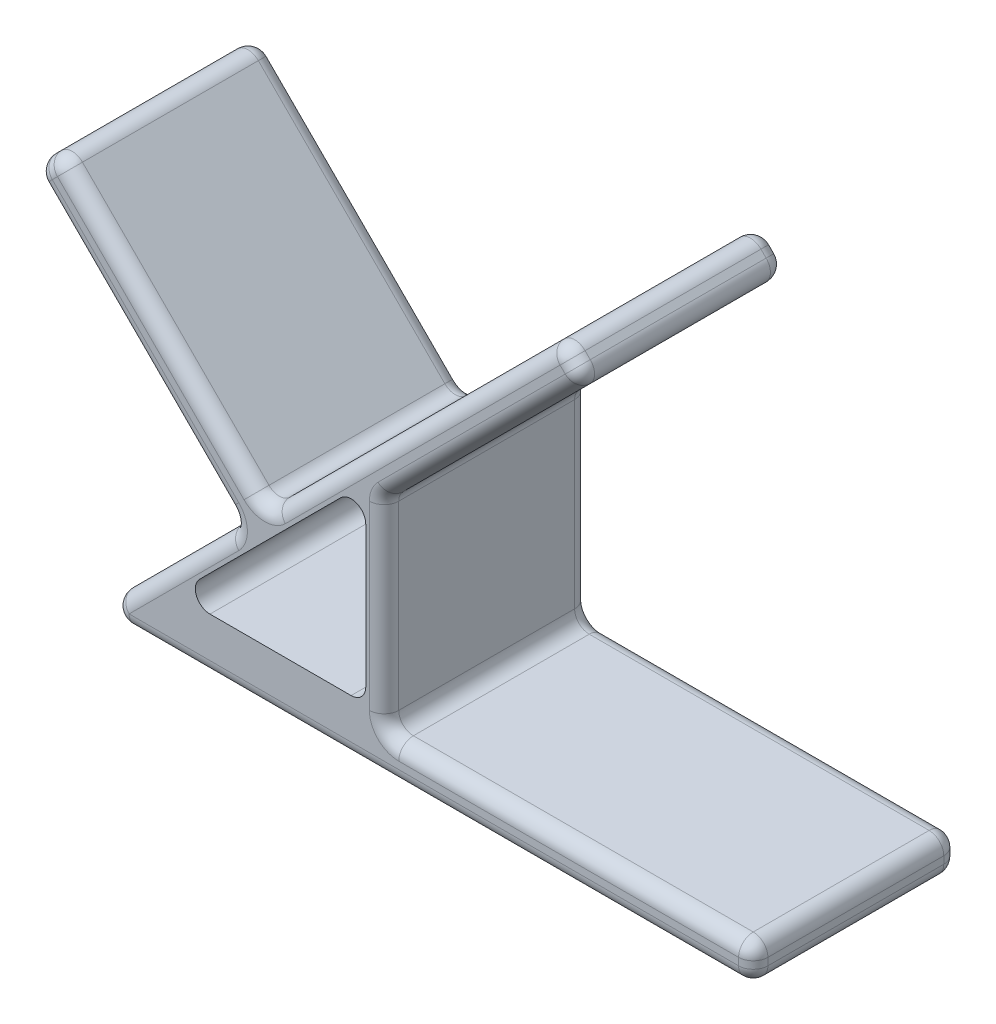
from build123d import *

# Parameters (mm, degrees)
BOSS_EXTRUDE1_DEPTH = 35.56
SKETCH3_W           = 35.56
SKETCH3_H           = 6.35
BOSS_EXTRUDE2_DEPTH = 50.8
BOSS_EXTRUDE4_DEPTH = 35.56
CUT_EXTRUDE1_DEPTH  = 45.72
FILLET5_R           = 2.54


with BuildPart() as part:
    # Sketch2 → Boss-Extrude1 (new body)
    with BuildSketch(Plane.XY):
        Polygon((0, 0), (-114.3, 0), (-33.47769491, 80.82230509), (-28.98756685, 76.332177029), (-98.969743879, 6.35), (0, 6.35), align=None)
    extrude(amount=BOSS_EXTRUDE1_DEPTH)

    # Sketch3 → Boss-Extrude2 (add)
    with BuildSketch(Plane(origin=(-57.15, 57.15, 0), x_dir=(0, 0, 1), z_dir=(-0.707106781186544, 0.7071067811865511, 0))):
        with Locations((17.78, -42.08730509)):
            Rectangle(SKETCH3_W, SKETCH3_H)
    extrude(amount=BOSS_EXTRUDE2_DEPTH)

    # Sketch5 → Boss-Extrude4 (add)
    with BuildSketch(Plane.XY.offset(35.56)):
        Polygon((-98.969743879, 6.35), (-63.978655364, 41.341088515), (-63.978655364, 6.35), align=None)
    extrude(amount=-BOSS_EXTRUDE4_DEPTH)

    # Sketch6 → Cut-Extrude1 (cut)
    with BuildSketch(Plane(origin=(0, 0, 0), x_dir=(-1, 0, 0), z_dir=(0, 0, -1))):
        Polygon((67.153655364, 42.656216575), (67.153655364, 9.525), (100.284871939, 9.525), align=None)
    extrude(amount=-CUT_EXTRUDE1_DEPTH, mode=Mode.SUBTRACT)

    # Fillet5
    fillet5_edges = [part.edges().sort_by_distance(p)[0] for p in [
        (0, 6.35, 17.78),
        (-28.98756685, 76.332177029, 17.78),
        (-33.47769491, 80.82230509, 17.78),
        (-114.3, 0, 17.78),
        (0, 0, 17.78),
        (-57.15, 0, 35.56),
        (-59.071424855, 55.228575145, 35.56),
        (-101.727641431, 12.572358569, 35.56),
        (-31.23263088, 78.577241059, 35.56),
        (-46.483111107, 58.836632772, 35.56),
        (-31.989327682, 6.35, 35.56),
        (0, 3.175, 35.56),
        (-57.15, 0, 0),
        (-59.071424855, 55.228575145, 0),
        (-101.727641431, 12.572358569, 0),
        (-31.23263088, 78.577241059, 0),
        (-46.483111107, 58.836632772, 0),
        (-31.989327682, 6.35, 0),
        (0, 3.175, 0),
        (-107.115795103, 43.105229381, 0),
        (-107.115795103, 43.105229381, 35.56),
        (-102.625667043, 47.595357442, 35.56),
        (-102.625667043, 47.595357442, 0),
        (-120.586179285, 65.555869684, 17.78),
        (-122.831243315, 63.310805654, 35.56),
        (-125.076307345, 61.065741623, 17.78),
        (-122.831243315, 63.310805654, 0),
        (-84.6651548, 29.6348452, 17.78),
        (-89.155282861, 25.144717139, 17.78),
        (-63.978655364, 41.341088515, 17.78),
        (-63.978655364, 6.35, 17.78),
        (-63.978655364, 23.845544257, 0),
        (-63.978655364, 23.845544257, 35.56),
        (-100.284871939, 9.525, 17.78),
        (-67.153655364, 9.525, 17.78),
        (-67.153655364, 42.656216575, 17.78),
    ]]
    fillet(fillet5_edges, radius=FILLET5_R)


solid = part.part
